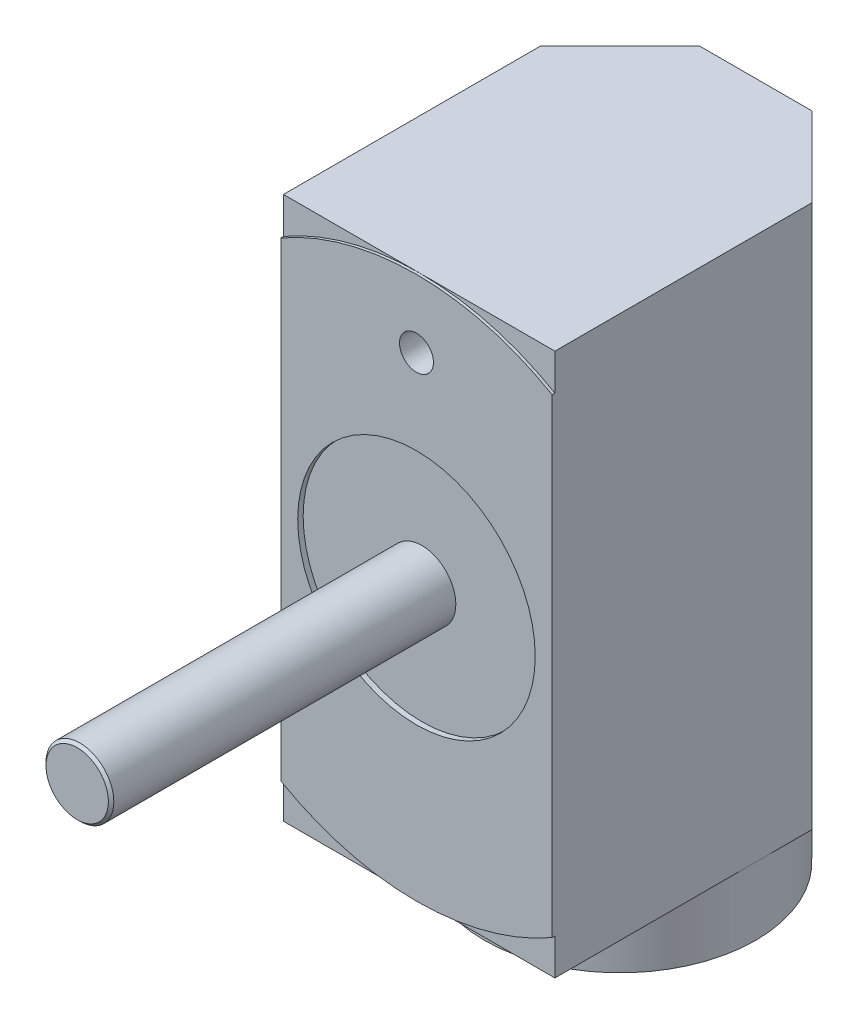
from build123d import *

# Parameters (mm, degrees)
BOSS_EXTRUDE2_DEPTH = 25.4
SKETCH2_R           = 6.35
BOSS_EXTRUDE3_DEPTH = 3.175
SKETCH3_R           = 4.7625
CUT_EXTRUDE1_DEPTH  = 26.19375
SKETCH4_R           = 1.5875
BOSS_EXTRUDE4_DEPTH = 15.875
CUT_EXTRUDE2_START  = -0.254
SKETCH5_R           = 5.55625
SKETCH5_R_2         = 1.5875
CUT_EXTRUDE2_DEPTH  = 0.254
CUT_EXTRUDE4_DEPTH  = 0.127
SKETCH4_4_R         = 0.79375
CUT_EXTRUDE6_DEPTH  = 5.588
CHAMFER1_SIZE       = 0.127


with BuildPart() as part:
    # Sketch1 → Boss-Extrude2 (new body)
    with BuildSketch(Plane(origin=(0, 0, 0), x_dir=(1, 0, 0), z_dir=(0, 1, 0))):
        Polygon((6.35, -9.525), (-6.35, -9.525), (-6.35, 2.630256121), (-2.630256121, 6.35), (2.630256121, 6.35), (6.35, 2.630256121), align=None)
    extrude(amount=-BOSS_EXTRUDE2_DEPTH)

    # Sketch2 → Boss-Extrude3 (add)
    with BuildSketch(Plane.XZ.offset(25.4)):
        with Locations(Location((0, 0, 0), (0, 0, 270))):
            Circle(SKETCH2_R)
    extrude(amount=BOSS_EXTRUDE3_DEPTH)

    # Sketch3 → Cut-Extrude1 (cut)
    with BuildSketch(Plane.XZ.offset(28.575)):
        with Locations(Location((0, 0, 0), (0, 0, 270))):
            Circle(SKETCH3_R)
    extrude(amount=-CUT_EXTRUDE1_DEPTH, mode=Mode.SUBTRACT)

    # Sketch4 → Boss-Extrude4 (add)
    with BuildSketch(Plane.XY.offset(9.525)):
        with Locations((0, -12.7)):
            Circle(SKETCH4_R)
    extrude(amount=BOSS_EXTRUDE4_DEPTH)

    # Sketch5 → Cut-Extrude2 (cut)
    with BuildSketch(Plane.XY.offset(9.525).offset(CUT_EXTRUDE2_START)):
        with Locations((0, -12.7)):
            Circle(SKETCH5_R)
        with Locations((0, -12.7)):
            Circle(SKETCH5_R_2, mode=Mode.SUBTRACT)
    extrude(amount=CUT_EXTRUDE2_DEPTH, mode=Mode.SUBTRACT)

    # Sketch5<4> → Cut-Extrude4 (cut)
    with BuildSketch(Plane.XY.offset(9.525)):
        with BuildLine():
            ThreePointArc((0, 0), (3.287001873, -0.432742006), (6.35, -1.701477372))
            Line((6.35, -1.701477372), (6.35, 0))
            Line((6.35, 0), (0, 0))
        make_face()
        with BuildLine():
            ThreePointArc((-6.35, -1.701477372), (-3.287001873, -0.432742006), (0, 0))
            Line((0, 0), (-6.35, 0))
            Line((-6.35, 0), (-6.35, -1.701477372))
        make_face()
        with BuildLine():
            Line((-6.35, -25.4), (0, -25.4))
            ThreePointArc((0, -25.4), (-3.287001873, -24.967257994), (-6.35, -23.698522628))
            Line((-6.35, -23.698522628), (-6.35, -25.4))
        make_face()
        with BuildLine():
            Line((6.35, -25.4), (6.35, -23.698522628))
            ThreePointArc((6.35, -23.698522628), (3.287001873, -24.967257994), (0, -25.4))
            Line((0, -25.4), (6.35, -25.4))
        make_face()
    extrude(amount=-CUT_EXTRUDE4_DEPTH, mode=Mode.SUBTRACT)

    # Sketch4<4> → Cut-Extrude6 (cut)
    with BuildSketch(Plane.XY.offset(9.525)):
        with Locations((0, -3.175)):
            Circle(SKETCH4_4_R)
    extrude(amount=-CUT_EXTRUDE6_DEPTH, mode=Mode.SUBTRACT)

    # Chamfer1
    chamfer1_edges = [part.edges().sort_by_distance(p)[0] for p in [
        (-1.5875, -12.7, 25.4),
    ]]
    chamfer(chamfer1_edges, length=CHAMFER1_SIZE)


solid = part.part
